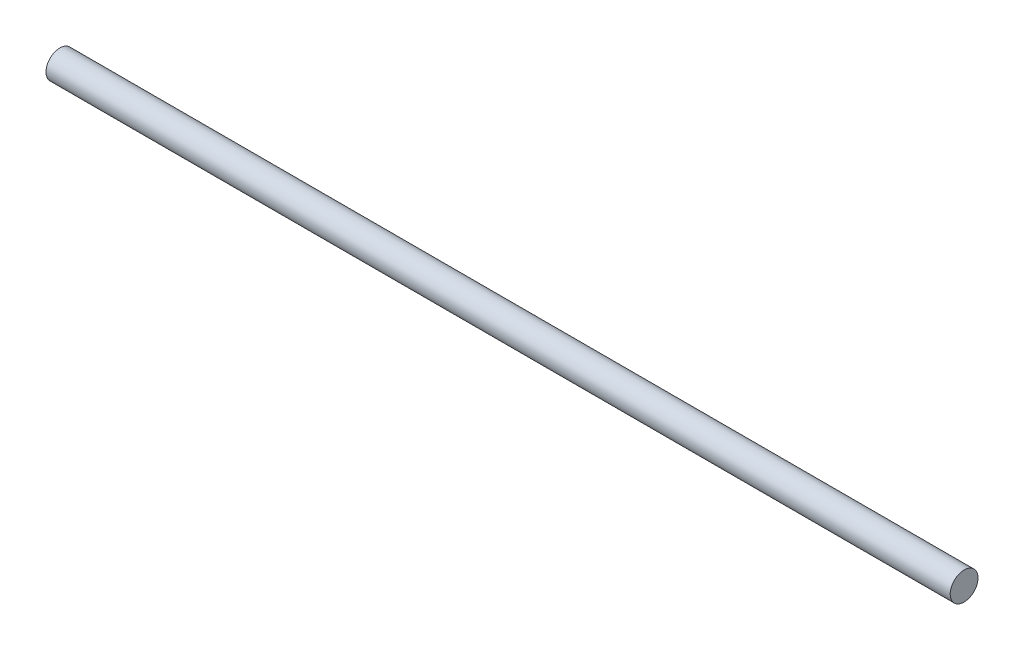
from build123d import *

# Parameters (mm, degrees)
ESBO_O1_W = 130
ESBO_O1_H = 2


with BuildPart() as part:
    # Esboço1 → Revolução1 (revolve)
    with BuildSketch(Plane.XY):
        with Locations((65, 1)):
            Rectangle(ESBO_O1_W, ESBO_O1_H)
    revolve(axis=Axis((130, 0, 0), (-1, 0, 0)))


solid = part.part
